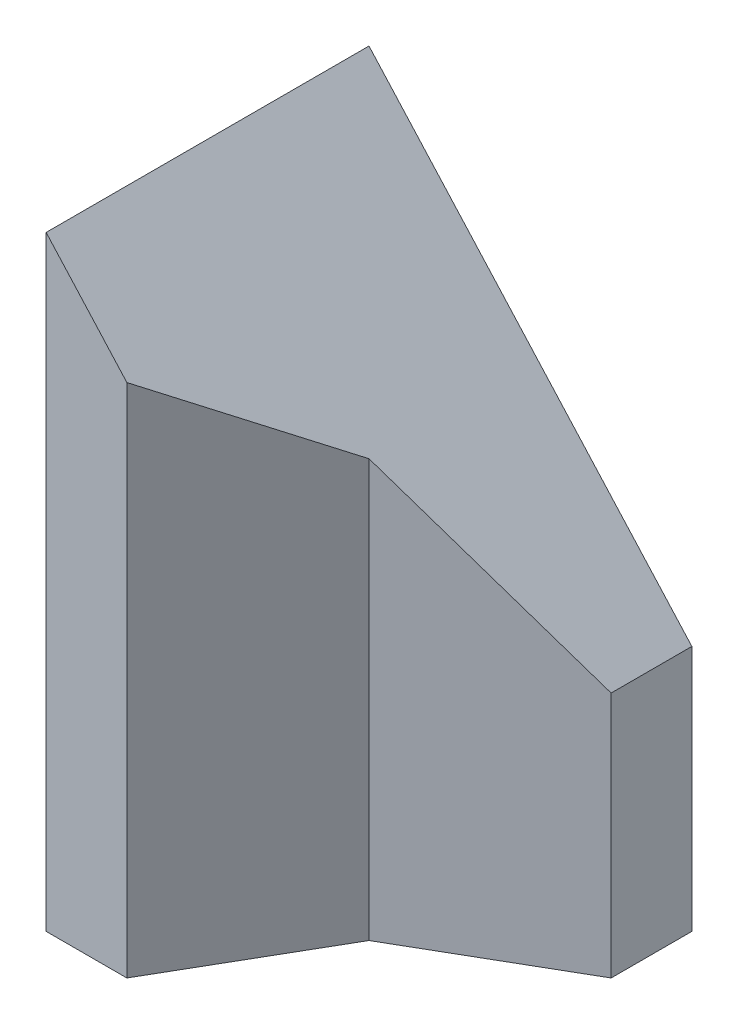
from build123d import *

# Parameters (mm, degrees)
BOSS_EXTRUDE1_DEPTH     = 95.25
CUT_EXTRUDE1_DEPTH      = 120.305668348
CUT_EXTRUDE1_DEPTH_BACK = 120.305668348


with BuildPart() as part:
    # Sketch1 → Boss-Extrude1 (new body)
    with BuildSketch(Plane(origin=(0, 0, 0), x_dir=(1, 0, 0), z_dir=(0, 1, 0))):
        Polygon((50.8, 0), (0, 0), (0, -50.8), (12.7, -50.8), (26.645567884, -26.645567884), (50.8, -12.7), align=None)
    extrude(amount=BOSS_EXTRUDE1_DEPTH)

    # Sketch2 → Cut-Extrude1 (cut, two sides: drawn at the far end of the back side and taken through both)
    with BuildSketch(Plane.XY.offset(-CUT_EXTRUDE1_DEPTH_BACK)):
        Polygon((-151.156603976, 263.126416075), (0, 95.25), (50.8, 38.830884247), (201.956603976, -129.045531829), (537.709436127, 173.267676124), (184.596228174, 565.439624028), align=None)
    extrude(amount=CUT_EXTRUDE1_DEPTH + CUT_EXTRUDE1_DEPTH_BACK, mode=Mode.SUBTRACT)


solid = part.part
